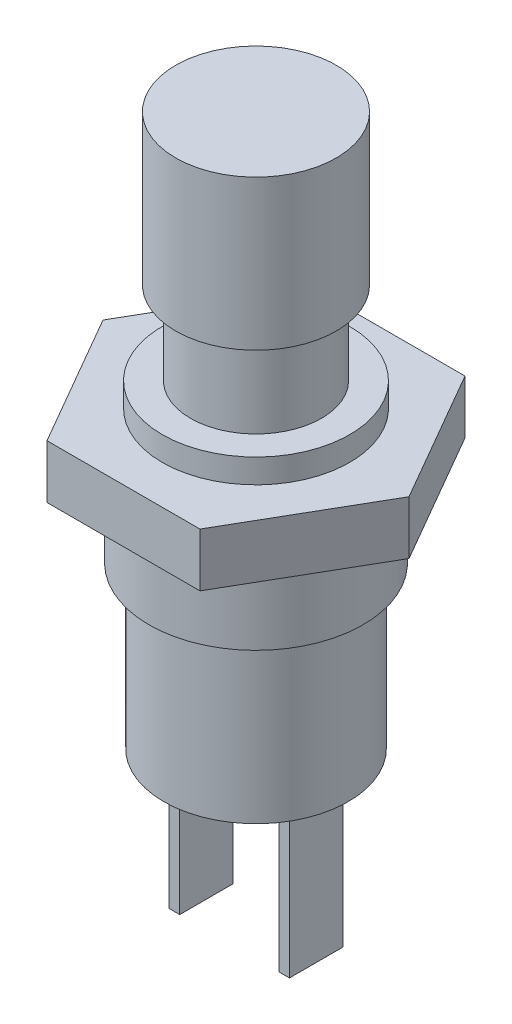
from build123d import *

# Parameters (mm, degrees)
SKETCH2_R           = 6.57086473
CUT_EXTRUDE3_DEPTH  = 5
SKETCH3_W           = 0.4
SKETCH3_H           = 2
BOSS_EXTRUDE2_DEPTH = 5.8


with BuildPart() as part:
    # Sketch1 → Revolve2 (revolve)
    with BuildSketch(Plane.XY, mode=Mode.PRIVATE) as revolve2_sk:
        Polygon((0, 20.6), (3, 20.6), (3, 15), (2.446439684, 15), (2.446439684, 11.9), (3.5, 11.9), (3.5, 11), (5.715, 11), (5.715, 9), (4, 9), (4, 6), (3.444705053, 6), (3.444705053, 0), (0, 0), align=None)
    revolve(revolve2_sk.sketch.rotate(Axis((0, 22.726966954, 0), (0, -1, 0)), 90), axis=Axis((0, 22.726966954, 0), (0, -1, 0)))

    # Sketch2 → Cut-Extrude3 (cut)
    with BuildSketch(Plane(origin=(0, 11, 0), x_dir=(1, 0, 0), z_dir=(0, 1, 0))):
        Circle(SKETCH2_R)
        Polygon((5.715, 0), (2.8575, 4.949335183), (-2.8575, 4.949335183), (-5.715, 0), (-2.8575, -4.949335183), (2.8575, -4.949335183), align=None, mode=Mode.SUBTRACT)
    extrude(amount=-CUT_EXTRUDE3_DEPTH, mode=Mode.SUBTRACT)

    # Sketch3 → Boss-Extrude2 (add)
    with BuildSketch(Plane.XZ):
        with Locations((-2.05, 0)):
            Rectangle(SKETCH3_W, SKETCH3_H)
        with Locations((2.05, 0)):
            Rectangle(SKETCH3_W, SKETCH3_H)
    extrude(amount=BOSS_EXTRUDE2_DEPTH)


solid = part.part
